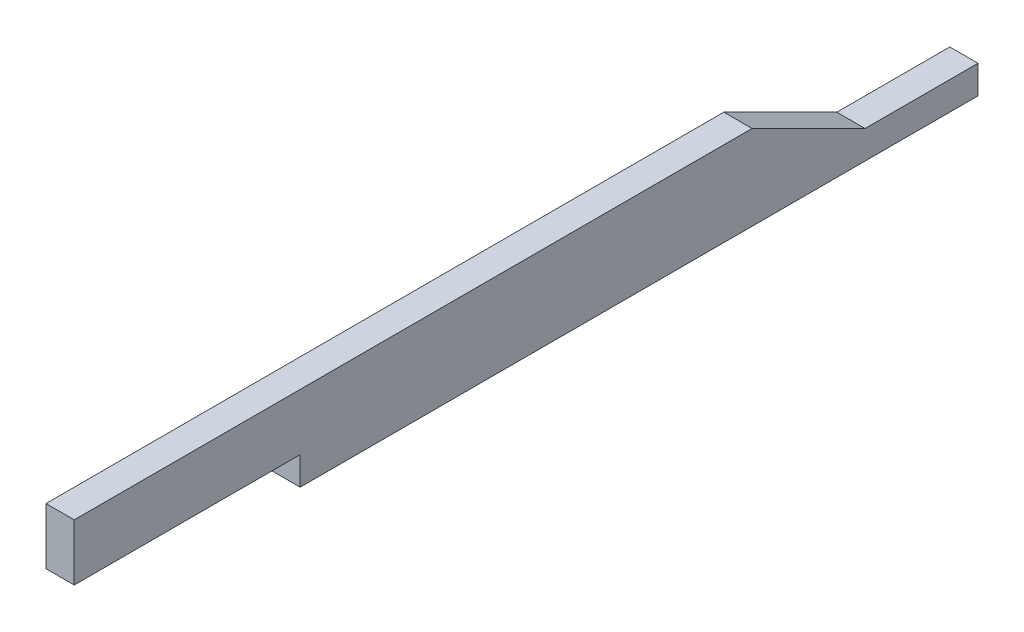
from build123d import *

# Parameters (mm, degrees)
SKETCH1_W           = 6.35
SKETCH1_H           = 19.05
BOSS_EXTRUDE1_DEPTH = 203.2
SKETCH2_W           = 50.8
SKETCH2_H           = 6.35
CUT_EXTRUDE1_DEPTH  = 203.2
CUT_EXTRUDE2_DEPTH  = 203.2


with BuildPart() as part:
    # Sketch1 → Boss-Extrude1 (new body)
    with BuildSketch(Plane.XY):
        with Locations((-3.175, 9.525)):
            Rectangle(SKETCH1_W, SKETCH1_H)
    extrude(amount=BOSS_EXTRUDE1_DEPTH)

    # Sketch2 → Cut-Extrude1 (cut)
    with BuildSketch(Plane.ZY.offset(6.35)):
        with Locations((177.8, 3.175)):
            Rectangle(SKETCH2_W, SKETCH2_H)
    extrude(amount=-CUT_EXTRUDE1_DEPTH, mode=Mode.SUBTRACT)

    # Sketch3 → Cut-Extrude2 (cut)
    with BuildSketch(Plane.ZY.offset(6.35)):
        Polygon((0, 6.35), (25.4, 6.35), (50.8, 19.05), (0, 19.05), align=None)
    extrude(amount=-CUT_EXTRUDE2_DEPTH, mode=Mode.SUBTRACT)


solid = part.part
